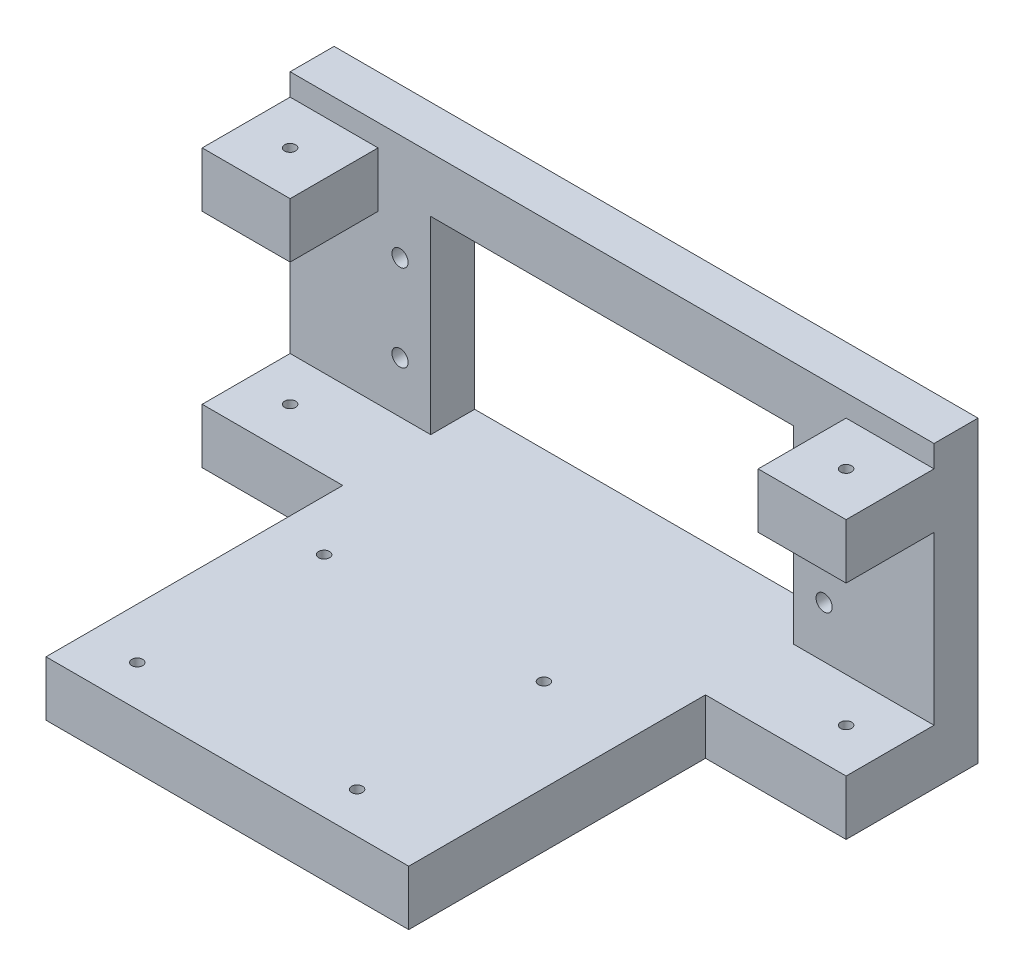
from build123d import *

# Parameters (mm, degrees)
SKETCH1_W            = 54.61
SKETCH1_H            = 47.244
SKETCH1_W_2          = 41.91
SKETCH1_H_2          = 21.844
BOSS_EXTRUDE1_DEPTH  = 5.08
SKETCH2_R            = 0.93599
CUT_EXTRUDE1_DEPTH   = 73.388217522
SKETCH10_W           = 14.41958
SKETCH10_H           = 19.49958
SKETCH10_R           = 0.635
BOSS_EXTRUDE4_DEPTH  = 5.08
SKETCH11_R           = 0.635
SKETCH11_W           = 3.302
SKETCH11_H           = 76.2
BOSS_EXTRUDE5_DEPTH  = 5.08
SKETCH12_W           = 60.452
SKETCH12_H           = 6.35
SKETCH12_W_2         = 59.182
CUT_EXTRUDE2_DEPTH   = 95.448366629
SKETCH13_W           = 7.0195552
SKETCH13_H           = 78.993394517
BOSS_EXTRUDE6_DEPTH  = 4.826
FILLET1_R            = 2.54
CUT_EXTRUDE3_DEPTH   = 95.448366629
SKETCH15_W           = 9.078627065
SKETCH15_H           = 34.544
BOSS_EXTRUDE7_DEPTH  = 5.08
SKETCH16_W           = 10.16
SKETCH16_H           = 6.35
BOSS_EXTRUDE8_DEPTH  = 10.16
SKETCH19_W           = 41.91
SKETCH19_H           = 6.35
BOSS_EXTRUDE10_DEPTH = 44.45
SKETCH20_W           = 16.24457
SKETCH20_H           = 10.16
BOSS_EXTRUDE11_DEPTH = 6.35
SKETCH17_R           = 0.635
CUT_EXTRUDE4_DEPTH   = 88.397462588
SKETCH21_R           = 0.635
CUT_EXTRUDE5_DEPTH   = 89.359200918


with BuildPart() as part:
    # Sketch1 → Boss-Extrude1 (new body)
    with BuildSketch(Plane.XY):
        with Locations((27.305, 23.622)):
            Rectangle(SKETCH1_W, SKETCH1_H)
        with Locations((27.305, 23.622)):
            Rectangle(SKETCH1_W_2, SKETCH1_H_2, mode=Mode.SUBTRACT)
    extrude(amount=BOSS_EXTRUDE1_DEPTH)

    # Sketch2 → Cut-Extrude1 (cut, through all)
    with BuildSketch(Plane.XY.offset(5.08)):
        with Locations((2.80543, 28.62199)):
            Circle(SKETCH2_R)
        with Locations((2.80543, 18.62201)):
            Circle(SKETCH2_R)
        with Locations((51.80457, 28.62199)):
            Circle(SKETCH2_R)
        with Locations((51.80457, 18.62201)):
            Circle(SKETCH2_R)
    extrude(amount=-CUT_EXTRUDE1_DEPTH, mode=Mode.SUBTRACT)

    # Sketch10 → Boss-Extrude4 (add)
    with BuildSketch(Plane.XY.offset(5.08)):
        with Locations((61.81979, 23.622)):
            Rectangle(SKETCH10_W, SKETCH10_H)
        with Locations((64.35979, 21.49221)):
            Circle(SKETCH10_R, mode=Mode.SUBTRACT)
        with Locations((64.35979, 25.75179)):
            Circle(SKETCH10_R, mode=Mode.SUBTRACT)
    extrude(amount=-BOSS_EXTRUDE4_DEPTH)

    # Sketch11 → Boss-Extrude5 (add)
    with BuildSketch(Plane.XY.offset(5.08)):
        Polygon((0, 47.244), (-5.842, 47.244), (-5.842, 64.262), (-15.748, 64.262), (-15.748, -17.018), (-4.572, -17.018), (-4.572, 0), (0, 0), align=None)
        with Locations(Location((-4.572, 21.49221, 0), (0, 0, 180))):
            Circle(SKETCH11_R, mode=Mode.SUBTRACT)
        with Locations(Location((-4.572, 25.75179, 0), (0, 0, 180))):
            Circle(SKETCH11_R, mode=Mode.SUBTRACT)
        with Locations((-10.795, 23.622)):
            Rectangle(SKETCH11_W, SKETCH11_H, mode=Mode.SUBTRACT)
    extrude(amount=-BOSS_EXTRUDE5_DEPTH)

    # Sketch12 → Cut-Extrude2 (cut, through all)
    with BuildSketch(Plane.XY.offset(5.08)):
        with Locations((24.384, 44.069)):
            Rectangle(SKETCH12_W, SKETCH12_H)
        with Locations((25.019, 3.175)):
            Rectangle(SKETCH12_W_2, SKETCH12_H)
    extrude(amount=-CUT_EXTRUDE2_DEPTH, mode=Mode.SUBTRACT)

    # Sketch13 → Boss-Extrude6 (add)
    with BuildSketch(Plane(origin=(0, 0, 0), x_dir=(-1, 0, 0), z_dir=(0, 0, -1))):
        with Locations((10.665198327, 23.388014827)):
            Rectangle(SKETCH13_W, SKETCH13_H)
    extrude(amount=-BOSS_EXTRUDE6_DEPTH)

    # Fillet1
    fillet1_edges = [part.edges().sort_by_distance(p)[0] for p in [
        (69.02958, 13.87221, 2.54),
        (54.61, 13.87221, 2.54),
        (54.61, 6.35, 2.54),
        (-4.572, 6.35, 2.54),
        (-4.572, -17.018, 2.54),
        (-15.748, -17.018, 2.54),
        (-15.748, 64.262, 2.54),
        (-5.842, 64.262, 2.54),
        (-5.842, 40.894, 2.54),
        (54.61, 40.894, 2.54),
        (54.61, 33.37179, 2.54),
        (69.02958, 33.37179, 2.54),
    ]]
    fillet(fillet1_edges, radius=FILLET1_R)

    # Sketch14 → Cut-Extrude3 (cut, through all)
    with BuildSketch(Plane.XY.offset(5.08)):
        Polygon((2.80543, 40.894), (-0.815942935, 40.894), (-0.815942935, 6.35), (2.80543, 6.35), (2.80543, -19.941776761), (-23.515321153, -19.941776761), (-23.515321153, 65.826532556), (2.80543, 65.826532556), align=None)
        Polygon((51.80457, 40.896870143), (51.80457, 65.826532556), (74.486186006, 65.826532556), (74.486186006, -19.941776761), (51.80457, -19.941776761), (52.07, 6.35), (54.61, 8.89), (54.61, 38.354), align=None)
    extrude(amount=-CUT_EXTRUDE3_DEPTH, mode=Mode.SUBTRACT)

    # Sketch15 → Boss-Extrude7 (add)
    with BuildSketch(Plane.XY.offset(5.08)):
        with Locations((-5.355256468, 23.622)):
            Rectangle(SKETCH15_W, SKETCH15_H)
        Polygon((51.807736495, 40.894), (54.61, 38.354), (54.61, 8.89), (52.07, 6.35), (64.50457, 6.35), (64.50457, 40.894), align=None)
    extrude(amount=-BOSS_EXTRUDE7_DEPTH)

    # Sketch16 → Boss-Extrude8 (add)
    with BuildSketch(Plane.XY.offset(5.08)):
        with Locations((-4.81457, 35.179)):
            Rectangle(SKETCH16_W, SKETCH16_H)
        with Locations((59.42457, 35.179)):
            Rectangle(SKETCH16_W, SKETCH16_H)
    extrude(amount=BOSS_EXTRUDE8_DEPTH)

    # Sketch19 → Boss-Extrude10 (add)
    with BuildSketch(Plane.XY.offset(5.08)):
        with Locations((27.305, 9.525)):
            Rectangle(SKETCH19_W, SKETCH19_H)
    extrude(amount=BOSS_EXTRUDE10_DEPTH)

    # Sketch20 → Boss-Extrude11 (add)
    with BuildSketch(Plane(origin=(0, 6.35, 0), x_dir=(-1, 0, 0), z_dir=(0, -1, 0))):
        with Locations((1.772285, -10.16)):
            Rectangle(SKETCH20_W, SKETCH20_H)
        with Locations((-56.382285, -10.16)):
            Rectangle(SKETCH20_W, SKETCH20_H)
    extrude(amount=-BOSS_EXTRUDE11_DEPTH)

    # Sketch17 → Cut-Extrude4 (cut, through all)
    with BuildSketch(Plane(origin=(0, 38.354, 0), x_dir=(1, 0, 0), z_dir=(0, 1, 0))):
        with Locations(Location((-4.81457, -10.16, 0), (0, 0, 180))):
            Circle(SKETCH17_R)
        with Locations(Location((59.42457, -10.16, 0), (0, 0, 270))):
            Circle(SKETCH17_R)
    extrude(amount=-CUT_EXTRUDE4_DEPTH, mode=Mode.SUBTRACT)

    # Sketch21 → Cut-Extrude5 (cut, through all)
    with BuildSketch(Plane.XZ.offset(-6.35)):
        with Locations(Location((37.592, 23.241, 0), (0, 0, 270))):
            Circle(SKETCH21_R)
        with Locations(Location((37.592, 44.831, 0), (0, 0, 270))):
            Circle(SKETCH21_R)
        with Locations(Location((12.192, 44.831, 0), (0, 0, 270))):
            Circle(SKETCH21_R)
        with Locations(Location((12.192, 23.241, 0), (0, 0, 270))):
            Circle(SKETCH21_R)
    extrude(amount=-CUT_EXTRUDE5_DEPTH, mode=Mode.SUBTRACT)


solid = part.part
